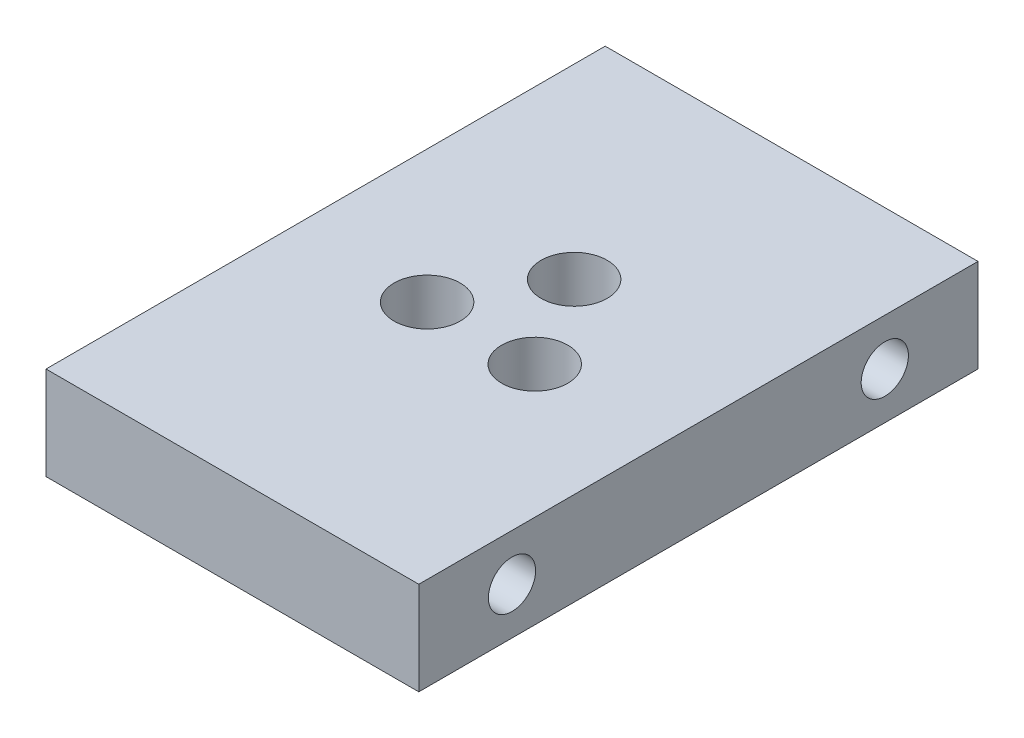
from build123d import *

# Parameters (mm, degrees)
SKETCH1_W                                            = 38.1
SKETCH1_H                                            = 57.15
BOSS_EXTRUDE1_DEPTH                                  = 9.525
CBORE_FOR_1_4_BINDING_HEAD_MACHINE_SCREW_D           = 6.7564
CBORE_FOR_1_4_BINDING_HEAD_MACHINE_SCREW_CBORE_D     = 14.2875
CBORE_FOR_1_4_BINDING_HEAD_MACHINE_SCREW_CBORE_DEPTH = 4.191
F_10_32_TAPPED_HOLE1_D                               = 4.0386
F_10_32_TAPPED_HOLE1_DEPTH                           = 12.7
F_10_32_TAPPED_HOLE1_CBORE_D                         = 4.826
F_10_32_TAPPED_HOLE1_CBORE_DEPTH                     = 9.652
F_10_32_TAPPED_HOLE1_TIP                             = 1.213317848
F_10_32_TAPPED_HOLE1_ON_FACE_2_D                     = 4.0386
F_10_32_TAPPED_HOLE1_ON_FACE_2_DEPTH                 = 12.7
F_10_32_TAPPED_HOLE1_ON_FACE_2_CBORE_D               = 4.826
F_10_32_TAPPED_HOLE1_ON_FACE_2_CBORE_DEPTH           = 9.652
F_10_32_TAPPED_HOLE1_ON_FACE_2_TIP                   = 1.213317848


with BuildPart() as part:
    # Sketch1 → Boss-Extrude1 (new body)
    with BuildSketch(Plane(origin=(0, 0, 0), x_dir=(1, 0, 0), z_dir=(0, 1, 0))):
        Rectangle(SKETCH1_W, SKETCH1_H)
    extrude(amount=BOSS_EXTRUDE1_DEPTH)

    # CBORE for 1/4 Binding Head Machine Screw1 (through all)
    with Locations(Plane(origin=(0, 0, 0), x_dir=(-1, 0, 0), z_dir=(0, -1, 0))):
        with Locations((0, 6.35), (5.499261314, -3.175), (-5.499261314, -3.175)):
            CounterBoreHole(CBORE_FOR_1_4_BINDING_HEAD_MACHINE_SCREW_D / 2, CBORE_FOR_1_4_BINDING_HEAD_MACHINE_SCREW_CBORE_D / 2, CBORE_FOR_1_4_BINDING_HEAD_MACHINE_SCREW_CBORE_DEPTH)

    # #10-32 Tapped Hole1
    with Locations(Plane(origin=(-19.05, 4.7625, -19.05), x_dir=(0, 0, -1), z_dir=(-1, 0, 0))):
        with Locations((0, 0), (-38.1, 0)):
            CounterBoreHole(F_10_32_TAPPED_HOLE1_D / 2, F_10_32_TAPPED_HOLE1_CBORE_D / 2, F_10_32_TAPPED_HOLE1_CBORE_DEPTH, depth=F_10_32_TAPPED_HOLE1_DEPTH)
            with Locations((0, 0, -(F_10_32_TAPPED_HOLE1_DEPTH + F_10_32_TAPPED_HOLE1_TIP / 2))):  # 118° drill point
                Cone(0, F_10_32_TAPPED_HOLE1_D / 2, F_10_32_TAPPED_HOLE1_TIP, mode=Mode.SUBTRACT)

    # #10-32 Tapped Hole1 on face 2
    with Locations(Plane(origin=(19.05, 4.7625, 19.05), x_dir=(0, 0, 1), z_dir=(1, 0, 0))):
        with Locations((0, 0), (-38.1, 0)):
            CounterBoreHole(F_10_32_TAPPED_HOLE1_ON_FACE_2_D / 2, F_10_32_TAPPED_HOLE1_ON_FACE_2_CBORE_D / 2, F_10_32_TAPPED_HOLE1_ON_FACE_2_CBORE_DEPTH, depth=F_10_32_TAPPED_HOLE1_ON_FACE_2_DEPTH)
            with Locations((0, 0, -(F_10_32_TAPPED_HOLE1_ON_FACE_2_DEPTH + F_10_32_TAPPED_HOLE1_ON_FACE_2_TIP / 2))):  # 118° drill point
                Cone(0, F_10_32_TAPPED_HOLE1_ON_FACE_2_D / 2, F_10_32_TAPPED_HOLE1_ON_FACE_2_TIP, mode=Mode.SUBTRACT)


solid = part.part
